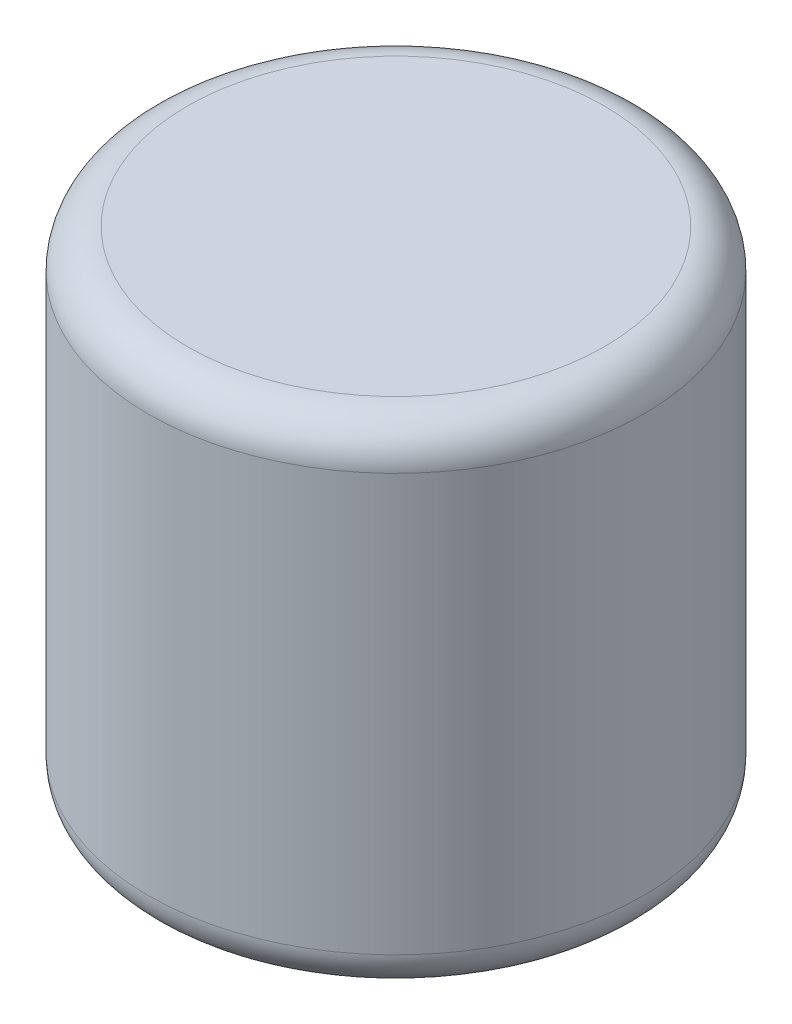
from build123d import *

# Parameters (mm, degrees)
SKETCH1_R           = 3.175
BOSS_EXTRUDE1_DEPTH = 3.175
FILLET1_R           = 0.5


with BuildPart() as part:
    # Sketch1 → Boss-Extrude1 (new, symmetric)
    with BuildSketch(Plane(origin=(0, 0, 0), x_dir=(1, 0, 0), z_dir=(0, 1, 0))):
        with Locations(Location((0, 0, 0), (0, 0, 270))):
            Circle(SKETCH1_R)
    extrude(amount=BOSS_EXTRUDE1_DEPTH, both=True)

    # Fillet1
    fillet1_edges = [part.edges().sort_by_distance(p)[0] for p in [
        (0, -3.175, -3.175),
        (0, 3.175, -3.175),
    ]]
    fillet(fillet1_edges, radius=FILLET1_R)


solid = part.part
